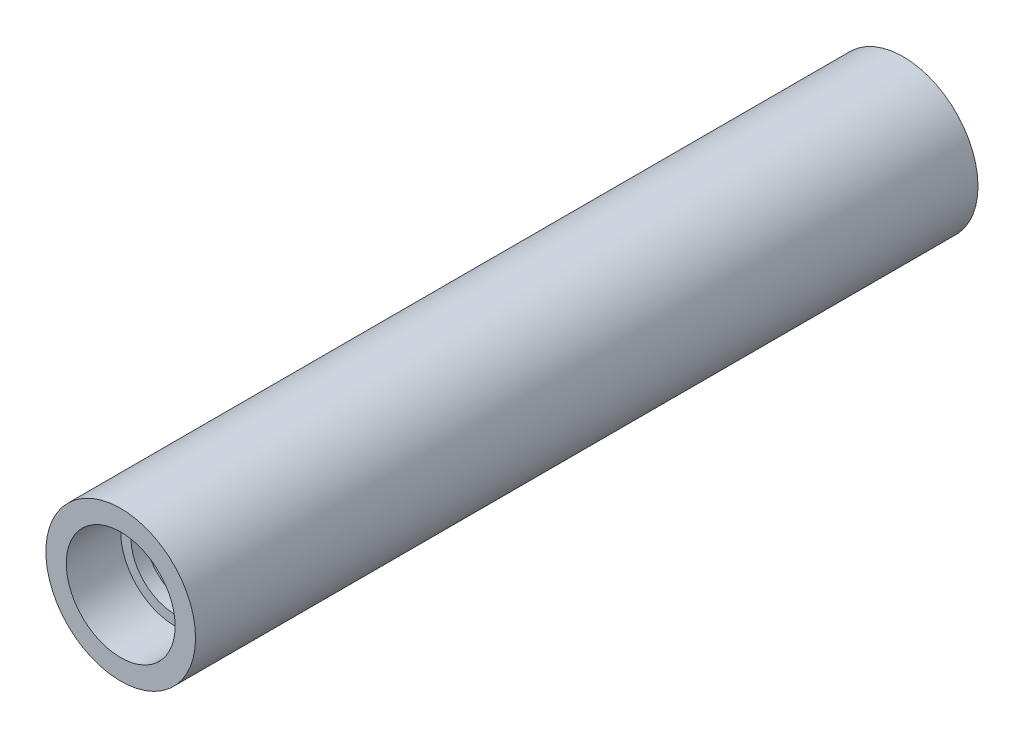
from build123d import *

# Parameters (mm, degrees)
SKETCH1_R           = 11
SKETCH1_R_2         = 8
BOSS_EXTRUDE1_DEPTH = 57.5
BOSS_EXTRUDE2_START = 47.5
SKETCH2_R           = 8
SKETCH2_R_2         = 6.5
BOSS_EXTRUDE2_DEPTH = 2


with BuildPart() as part:
    # Sketch1 → Boss-Extrude1 (new, symmetric)
    with BuildSketch(Plane.XY):
        Circle(SKETCH1_R)
        Circle(SKETCH1_R_2, mode=Mode.SUBTRACT)
    extrude(amount=BOSS_EXTRUDE1_DEPTH, both=True)

    # Sketch2 → Boss-Extrude2 (add)
    with BuildSketch(Plane.XY.offset(BOSS_EXTRUDE2_START)):
        Circle(SKETCH2_R)
        Circle(SKETCH2_R_2, mode=Mode.SUBTRACT)
    boss_extrude2 = extrude(amount=BOSS_EXTRUDE2_DEPTH)

    # Mirror1: Boss-Extrude2 across plane
    add(boss_extrude2.mirror(Plane.XY))


solid = part.part
